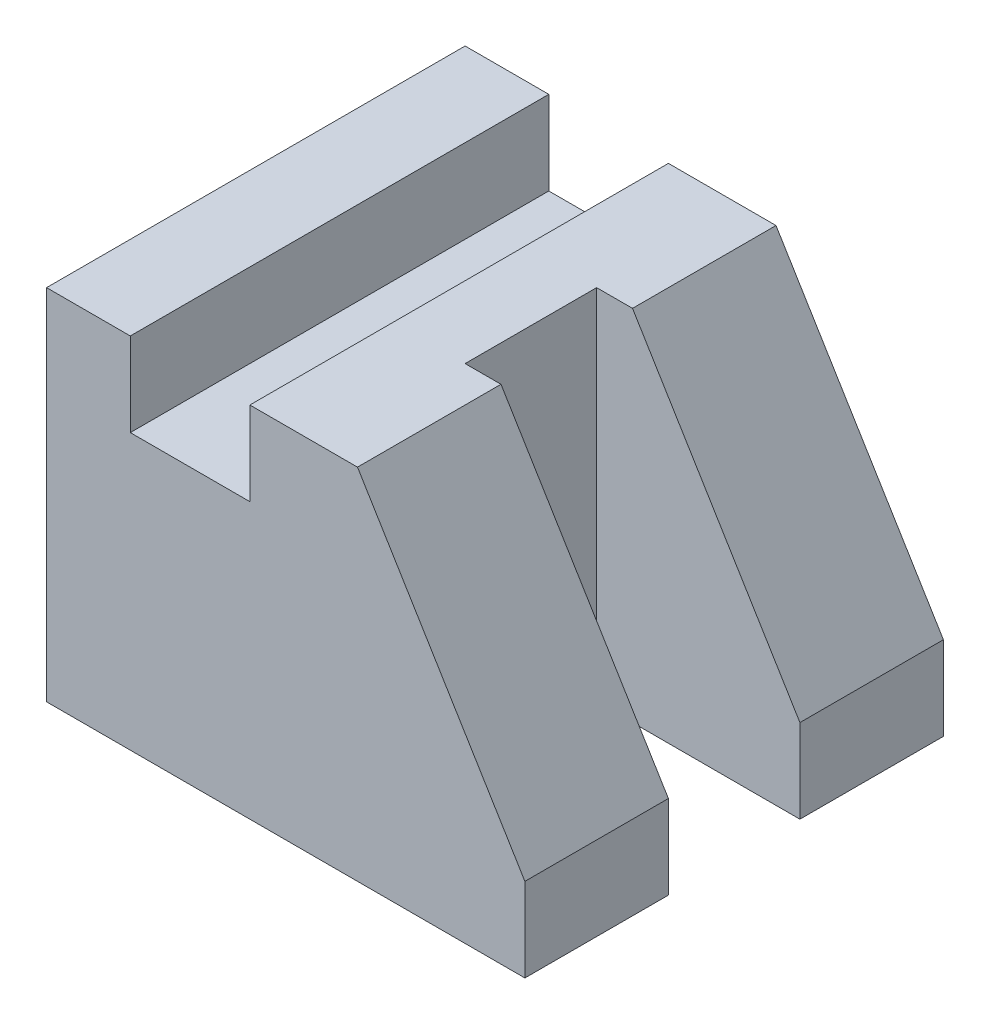
from build123d import *

# Parameters (mm, degrees)
Y_KSEKLIK_EKSTR_ZYON1_DEPTH = 70
IZIM2_OUTSIDE_W             = 106.414
IZIM2_OUTSIDE_H             = 96.414
KES_EKSTR_ZYON3_DEPTH       = 60


with BuildPart() as part:
    # Çizim1 → Yükseklik-Ekstrüzyon1 (new body)
    with BuildSketch(Plane.XY):
        Polygon((0, 0), (0, 60), (14, 60), (14, 46), (34, 46), (34, 60), (52, 60), (80, 14), (80, 0), align=None)
    extrude(amount=-Y_KSEKLIK_EKSTR_ZYON1_DEPTH)

    # Çizim2 outside → Kes-Ekstrüzyon3 (cut)
    with BuildSketch(Plane(origin=(0, 0, 0), x_dir=(1, 0, 0), z_dir=(0, 1, 0))):
        with Locations((40, 35)):
            Rectangle(IZIM2_OUTSIDE_W, IZIM2_OUTSIDE_H)
        Polygon((80, 70), (46, 70), (0, 70), (0, 0), (80, 0), (80, 24), (46, 24), (46, 46), (80, 46), align=None, mode=Mode.SUBTRACT)
    extrude(amount=KES_EKSTR_ZYON3_DEPTH, mode=Mode.SUBTRACT)


solid = part.part
